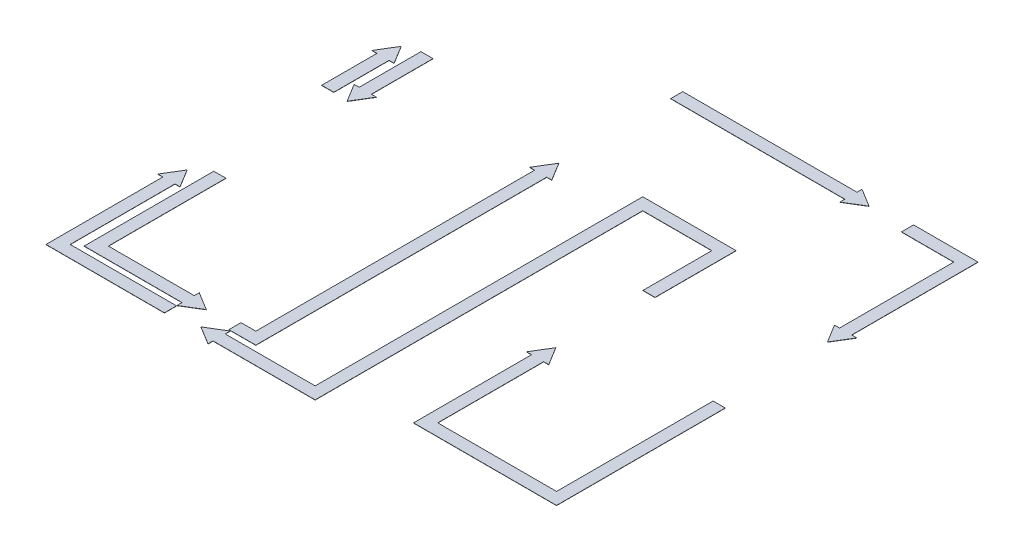
from build123d import *

# Parameters (mm, degrees)
BOSS_EXTRUDE2_DEPTH   = 0.5
BOSS_EXTRUDE2_2_DEPTH = 0.5
BOSS_EXTRUDE2_3_DEPTH = 0.5
BOSS_EXTRUDE2_4_DEPTH = 0.5
BOSS_EXTRUDE2_5_DEPTH = 0.5
BOSS_EXTRUDE2_6_DEPTH = 0.5
BOSS_EXTRUDE2_7_DEPTH = 0.5
BOSS_EXTRUDE2_8_DEPTH = 0.5
BOSS_EXTRUDE2_9_DEPTH = 0.5


with BuildPart() as part:
    # Sketch2 → Boss-Extrude2 (new body)
    with BuildSketch(Plane(origin=(0, 0, 0), x_dir=(1, 0, 0), z_dir=(0, 1, 0))):
        Polygon((-546.031568855, 319.862112689), (-546.031568855, 166.799956279), (-558.531568855, 166.799956279), (-531.031568855, 121.799956279), (-503.531568855, 166.799956279), (-516.031568855, 166.799956279), (-516.031568855, 319.862112689), align=None)
    extrude(amount=BOSS_EXTRUDE2_DEPTH)


with BuildPart() as body_2:
    # Sketch2 → Boss-Extrude2 2 (new body)
    with BuildSketch(Plane(origin=(0, 0, 0), x_dir=(1, 0, 0), z_dir=(0, 1, 0))):
        Polygon((-566.833224962, 124.583741857), (-566.833224962, 261.648764577), (-554.333224962, 261.648764577), (-581.833224962, 306.648764577), (-609.333224962, 261.648764577), (-596.833224962, 261.648764577), (-596.833224962, 124.583741857), align=None)
    extrude(amount=BOSS_EXTRUDE2_2_DEPTH)


with BuildPart() as body_3:
    # Sketch2 → Boss-Extrude2 3 (new body)
    with BuildSketch(Plane(origin=(0, 0, 0), x_dir=(1, 0, 0), z_dir=(0, 1, 0))):
        Polygon((-546.031568855, -193.74164228), (-546.031568855, -515.145479506), (-303.196960885, -515.145479506), (-303.196960885, -527.645479506), (-258.196960885, -500.145479506), (-303.196960885, -472.645479506), (-303.196960885, -485.145479506), (-516.031568855, -485.145479506), (-516.031568855, -193.74164228), align=None)
    extrude(amount=BOSS_EXTRUDE2_3_DEPTH)


with BuildPart() as body_4:
    # Sketch2 → Boss-Extrude2 4 (new body)
    with BuildSketch(Plane(origin=(0, 0, 0), x_dir=(1, 0, 0), z_dir=(0, 1, 0))):
        Polygon((-303.196960885, -529.017288308), (-566.833224962, -529.017288308), (-566.833224962, -269.169915432), (-554.333224962, -269.169915432), (-581.833224962, -224.169915432), (-609.333224962, -269.169915432), (-596.833224962, -269.169915432), (-596.833224962, -559.017288308), (-303.196960885, -559.017288308), align=None)
    extrude(amount=BOSS_EXTRUDE2_4_DEPTH)


with BuildPart() as body_5:
    # Sketch2 → Boss-Extrude2 5 (new body)
    with BuildSketch(Plane(origin=(0, 0, 0), x_dir=(1, 0, 0), z_dir=(0, 1, 0))):
        Polygon((-187.162371639, -515.145479506), (-120.490718616, -515.145479506), (-120.490718616, 206.224391534), (-107.990718616, 206.224391534), (-135.490718616, 251.224391534), (-162.990718616, 206.224391534), (-150.490718616, 206.224391534), (-150.490718616, -485.145479506), (-187.162371639, -485.145479506), align=None)
    extrude(amount=BOSS_EXTRUDE2_5_DEPTH)


with BuildPart() as body_6:
    # Sketch2 → Boss-Extrude2 6 (new body)
    with BuildSketch(Plane(origin=(0, 0, 0), x_dir=(1, 0, 0), z_dir=(0, 1, 0))):
        Polygon((271.952509575, 82.408764577), (271.952509575, 283.223482013), (40.614122477, 283.223482013), (40.614122477, -529.017288308), (-182.557040075, -529.017288308), (-182.557040075, -516.517288308), (-227.557040075, -544.017288308), (-182.557040075, -571.517288308), (-182.557040075, -559.017288308), (70.614122477, -559.017288308), (70.614122477, 253.223482013), (241.952509575, 253.223482013), (241.952509575, 82.408764577), align=None)
    extrude(amount=BOSS_EXTRUDE2_6_DEPTH)


with BuildPart() as body_7:
    # Sketch2 → Boss-Extrude2 7 (new body)
    with BuildSketch(Plane(origin=(0, 0, 0), x_dir=(1, 0, 0), z_dir=(0, 1, 0))):
        Polygon((-135.490718616, 528.607988525), (296.456327596, 528.607988525), (296.456327596, 516.107988525), (341.456327596, 543.607988525), (296.456327596, 571.107988525), (296.456327596, 558.607988525), (-135.490718616, 558.607988525), align=None)
    extrude(amount=BOSS_EXTRUDE2_7_DEPTH)


with BuildPart() as body_8:
    # Sketch2 → Boss-Extrude2 8 (new body)
    with BuildSketch(Plane(origin=(0, 0, 0), x_dir=(1, 0, 0), z_dir=(0, 1, 0))):
        Polygon((436.816285163, 528.607988525), (566.502204629, 528.607988525), (566.502204629, 245.290532335), (554.002204629, 245.290532335), (581.502204629, 200.290532335), (609.002204629, 245.290532335), (596.502204629, 245.290532335), (596.502204629, 558.607988525), (436.816285163, 558.607988525), align=None)
    extrude(amount=BOSS_EXTRUDE2_8_DEPTH)


with BuildPart() as body_9:
    # Sketch2 → Boss-Extrude2 9 (new body)
    with BuildSketch(Plane(origin=(0, 0, 0), x_dir=(1, 0, 0), z_dir=(0, 1, 0))):
        Polygon((566.502204629, -68.121309006), (566.502204629, -456.449956977), (271.952509575, -456.449956977), (271.952509575, -193.74164228), (284.452509575, -193.74164228), (256.952509575, -148.74164228), (229.452509575, -193.74164228), (241.952509575, -193.74164228), (241.952509575, -486.449956977), (596.502204629, -486.449956977), (596.502204629, -68.121309006), align=None)
    extrude(amount=BOSS_EXTRUDE2_9_DEPTH)


solid = Compound([part.part, body_2.part, body_3.part, body_4.part, body_5.part, body_6.part, body_7.part, body_8.part, body_9.part])
